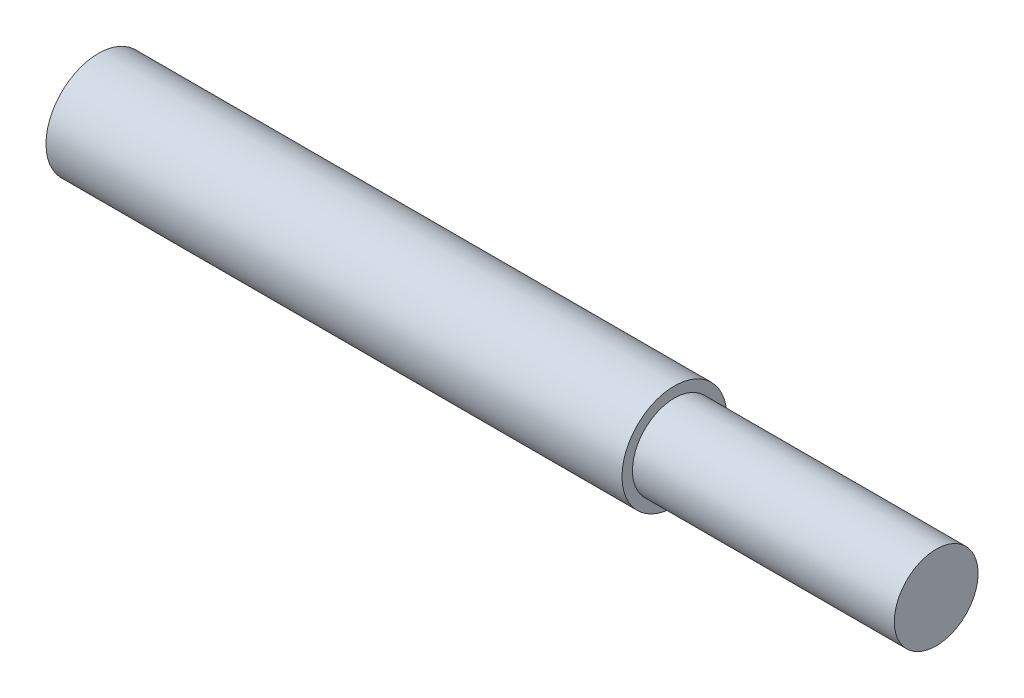
from build123d import *


with BuildPart() as part:
    # Sketch1 → Revolve1 (revolve)
    with BuildSketch(Plane.XY, mode=Mode.PRIVATE) as revolve1_sk:
        Polygon((0, 0), (0, 4), (-25, 4), (-25, 5), (-80, 5), (-80, 0), align=None)
    revolve(revolve1_sk.sketch.rotate(Axis((-80, 0, 0), (1, 0, 0)), 90), axis=Axis((-80, 0, 0), (1, 0, 0)))


solid = part.part
